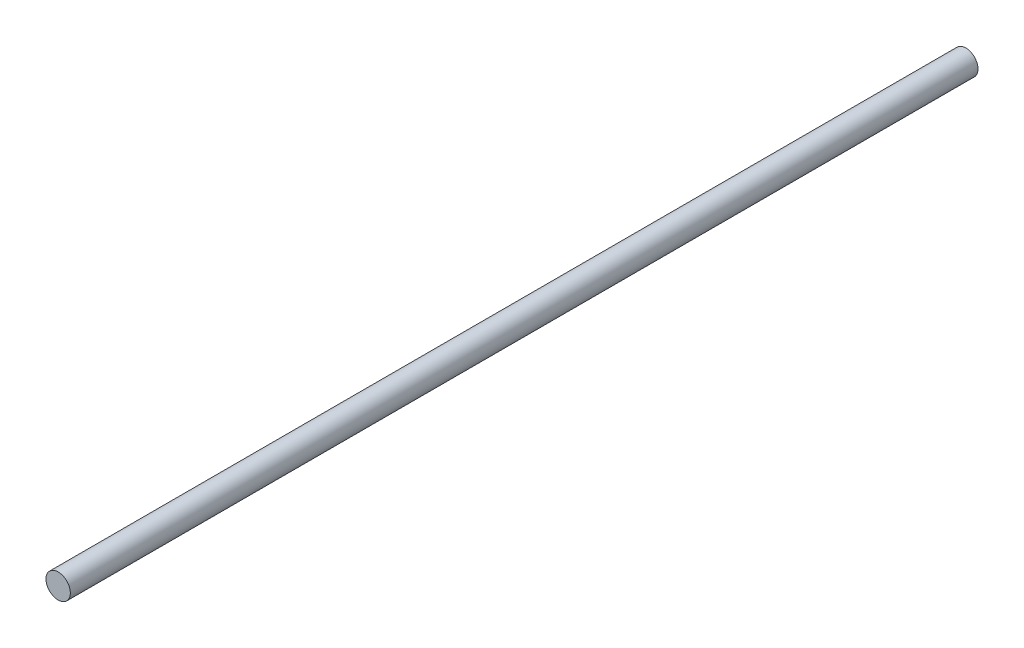
from build123d import *

# Parameters (mm, degrees)
BOSS_EXTRUDE1_DEPTH      = 2800
BOSS_EXTRUDE1_DEPTH_BACK = 1000
BASE_R                   = 51
CUT_EXTRUDE1_DEPTH       = 2790
CUT_EXTRUDE1_DEPTH_BACK  = 990
CUTOUT_R                 = 49.5


with BuildPart() as part:
    # base → Boss-Extrude1 (new, two sides: drawn at the far end of the back side and taken through both)
    with BuildSketch(Plane.XY.offset(-BOSS_EXTRUDE1_DEPTH_BACK)):
        Circle(BASE_R)
    extrude(amount=BOSS_EXTRUDE1_DEPTH + BOSS_EXTRUDE1_DEPTH_BACK)

    # cutout → Cut-Extrude1 (cut, two sides: drawn at the far end of the back side and taken through both)
    with BuildSketch(Plane.XY.offset(-CUT_EXTRUDE1_DEPTH_BACK)):
        Circle(CUTOUT_R)
    extrude(amount=CUT_EXTRUDE1_DEPTH + CUT_EXTRUDE1_DEPTH_BACK, mode=Mode.SUBTRACT)


solid = part.part
